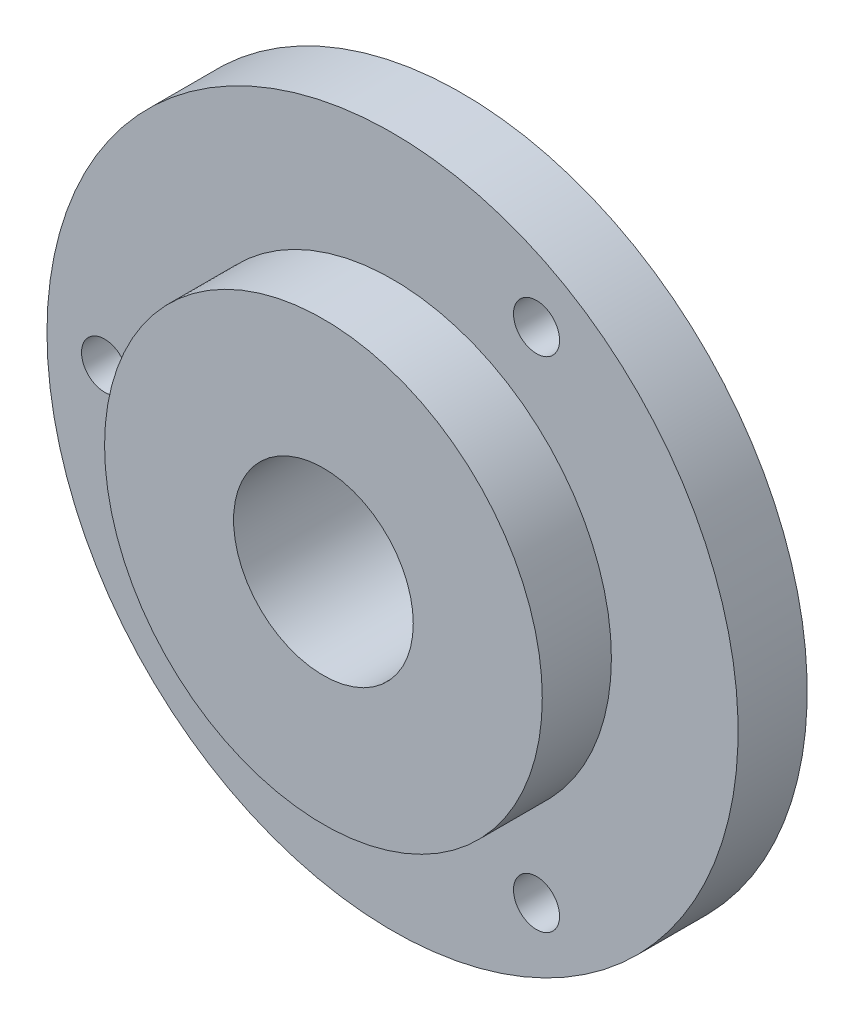
from build123d import *

# Parameters (mm, degrees)
SKETCH_1_R               = 9.5
EXTRUDE_1_DEPTH          = 3
SKETCH_2_R               = 15
EXTRUDE_2_DEPTH          = 3
SKETCH_3_R               = 3.9
CUT_EXTRUDE_3_DEPTH      = 23.045407685
SKETCH_4_R               = 1
CUT_EXTRUDE_4_DEPTH      = 22.424285286
PATTERN_CIRCULAR_1_COUNT = 3


with BuildPart() as part:
    # Эскиз1 → Бобышка-Вытянуть1 (new body)
    with BuildSketch(Plane.XY):
        Circle(SKETCH_1_R)
    extrude(amount=EXTRUDE_1_DEPTH)

    # Эскиз2 → Бобышка-Вытянуть2 (add)
    with BuildSketch(Plane(origin=(0, 0, 0), x_dir=(-1, 0, 0), z_dir=(0, 0, -1))):
        Circle(SKETCH_2_R)
    extrude(amount=EXTRUDE_2_DEPTH)

    # Эскиз3 → Вырез-Вытянуть3 (cut, through all)
    with BuildSketch(Plane.XY.offset(3)):
        Circle(SKETCH_3_R)
    extrude(amount=-CUT_EXTRUDE_3_DEPTH, mode=Mode.SUBTRACT)

    # Эскиз4 → Вырез-Вытянуть4 (cut, through all)
    with BuildSketch(Plane.XY):
        with Locations((-12.5, 0)):
            Circle(SKETCH_4_R)
    cut_extrude_4 = extrude(amount=-CUT_EXTRUDE_4_DEPTH, mode=Mode.SUBTRACT)

    # Круговой массив1: Вырез-Вытянуть4 ×3 about axis
    pattern_circular_1_axis = Axis((0, 0, 0), (0, 0, 1))
    for i in range(1, PATTERN_CIRCULAR_1_COUNT):
        add(cut_extrude_4.rotate(pattern_circular_1_axis, i * 360 / PATTERN_CIRCULAR_1_COUNT), mode=Mode.SUBTRACT)


solid = part.part
